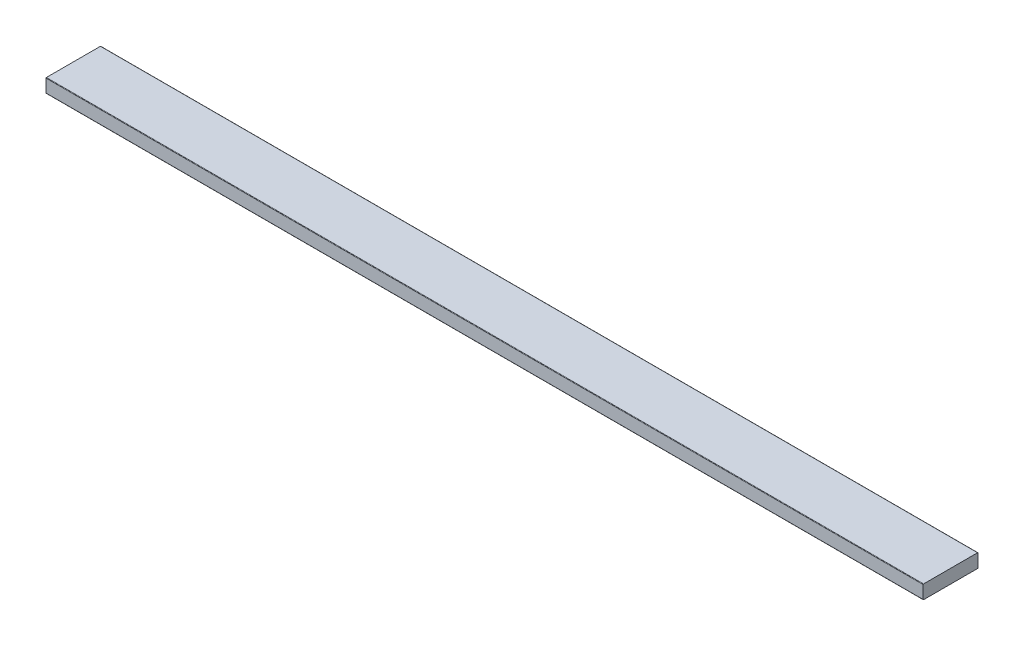
from build123d import *

# Parameters (mm, degrees)
BOSS_EXTRUDE1_DEPTH      = 4.7625
BOSS_EXTRUDE1_DEPTH_BACK = 4.7625
SKETCH3_W                = 609.6
SKETCH3_H                = 38.1
FILLET1_R                = 0.314325


with BuildPart() as part:
    # Sketch3 → Boss-Extrude1 (new, two sides: drawn at the far end of the back side and taken through both)
    with BuildSketch(Plane(origin=(0, 0, 0), x_dir=(1, 0, 0), z_dir=(0, 1, 0)).offset(-BOSS_EXTRUDE1_DEPTH_BACK)):
        Rectangle(SKETCH3_W, SKETCH3_H)
    extrude(amount=BOSS_EXTRUDE1_DEPTH + BOSS_EXTRUDE1_DEPTH_BACK)

    # Fillet1
    fillet1_edges = [part.edges().sort_by_distance(p)[0] for p in [
        (0, 4.7625, 19.05),
        (0, -4.7625, -19.05),
        (0, 4.7625, -19.05),
        (0, -4.7625, 19.05),
    ]]
    fillet(fillet1_edges, radius=FILLET1_R)


solid = part.part
